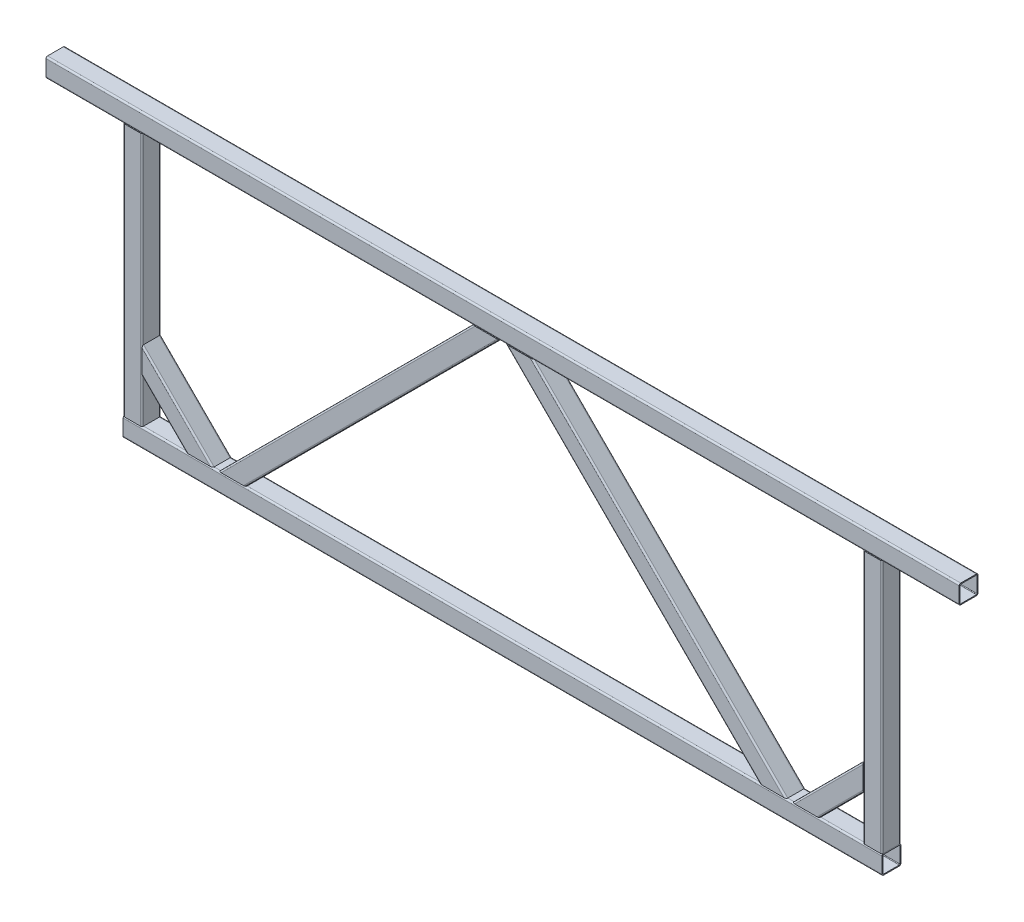
from build123d import *

# Parameters (mm, degrees)
F_60_X_40_X_3_2_1_DEPTH   = 2900
F_60_X_40_X_3_2_1_2_DEPTH = 2410
F_60_X_40_X_3_2_1_3_DEPTH = 868
F_60_X_40_X_3_2_1_4_DEPTH = 868
F_60_X_40_X_3_2_1_5_DEPTH = 428.703587107
F_60_X_40_X_3_2_1_6_DEPTH = 1311.561758757
F_60_X_40_X_3_2_1_7_DEPTH = 1311.561758757
F_60_X_40_X_3_2_1_8_DEPTH = 428.703587107


with BuildPart() as part:
    # Sketch1 → Прямоугольная труба 60 X 40 X 3.2(1) (new body)
    with BuildSketch(Plane(origin=(-1450, 433, 0), x_dir=(0, 1, 0), z_dir=(1, 0, 0))):
        with BuildLine():
            Line((-25, -30), (25, -30))
            ThreePointArc((25, -30), (28.535533906, -28.535533906), (30, -25))
            Line((30, -25), (30, 25))
            ThreePointArc((30, 25), (28.535533906, 28.535533906), (25, 30))
            Line((25, 30), (-25, 30))
            ThreePointArc((-25, 30), (-28.535533906, 28.535533906), (-30, 25))
            Line((-30, 25), (-30, -25))
            ThreePointArc((-30, -25), (-28.535533906, -28.535533906), (-25, -30))
        make_face()
        with BuildLine():
            Line((-25, -27), (25, -27))
            ThreePointArc((25, -27), (26.414213562, -26.414213562), (27, -25))
            Line((27, -25), (27, 25))
            ThreePointArc((27, 25), (26.414213562, 26.414213562), (25, 27))
            Line((25, 27), (-25, 27))
            ThreePointArc((-25, 27), (-26.414213562, 26.414213562), (-27, 25))
            Line((-27, 25), (-27, -25))
            ThreePointArc((-27, -25), (-26.414213562, -26.414213562), (-25, -27))
        make_face(mode=Mode.SUBTRACT)
    extrude(amount=F_60_X_40_X_3_2_1_DEPTH)


with BuildPart() as body_2:
    # Sketch1 on segment 2 (carried to segment 2) → 60 X 40 X 3.2_1 2 (new body)
    with BuildSketch(Plane(origin=(-1205, -433, 0), x_dir=(0, 1, 0), z_dir=(1, 0, 0))):
        with BuildLine():
            Line((-25, -30), (25, -30))
            ThreePointArc((25, -30), (28.535533906, -28.535533906), (30, -25))
            Line((30, -25), (30, 25))
            ThreePointArc((30, 25), (28.535533906, 28.535533906), (25, 30))
            Line((25, 30), (-25, 30))
            ThreePointArc((-25, 30), (-28.535533906, 28.535533906), (-30, 25))
            Line((-30, 25), (-30, -25))
            ThreePointArc((-30, -25), (-28.535533906, -28.535533906), (-25, -30))
        make_face()
        with BuildLine():
            Line((-25, -27), (25, -27))
            ThreePointArc((25, -27), (26.414213562, -26.414213562), (27, -25))
            Line((27, -25), (27, 25))
            ThreePointArc((27, 25), (26.414213562, 26.414213562), (25, 27))
            Line((25, 27), (-25, 27))
            ThreePointArc((-25, 27), (-26.414213562, 26.414213562), (-27, 25))
            Line((-27, 25), (-27, -25))
            ThreePointArc((-27, -25), (-26.414213562, -26.414213562), (-25, -27))
        make_face(mode=Mode.SUBTRACT)
    extrude(amount=F_60_X_40_X_3_2_1_2_DEPTH)


with BuildPart() as body_3:
    # Sketch1 on segment 3 (carried to segment 3) → 60 X 40 X 3.2_1 3 (new body)
    with BuildSketch(Plane(origin=(-1175, 434, 0), x_dir=(1, 0, 0), z_dir=(0, -1, 0))):
        with BuildLine():
            Line((-25, -30), (25, -30))
            ThreePointArc((25, -30), (28.535533906, -28.535533906), (30, -25))
            Line((30, -25), (30, 25))
            ThreePointArc((30, 25), (28.535533906, 28.535533906), (25, 30))
            Line((25, 30), (-25, 30))
            ThreePointArc((-25, 30), (-28.535533906, 28.535533906), (-30, 25))
            Line((-30, 25), (-30, -25))
            ThreePointArc((-30, -25), (-28.535533906, -28.535533906), (-25, -30))
        make_face()
        with BuildLine():
            Line((-25, -27), (25, -27))
            ThreePointArc((25, -27), (26.414213562, -26.414213562), (27, -25))
            Line((27, -25), (27, 25))
            ThreePointArc((27, 25), (26.414213562, 26.414213562), (25, 27))
            Line((25, 27), (-25, 27))
            ThreePointArc((-25, 27), (-26.414213562, 26.414213562), (-27, 25))
            Line((-27, 25), (-27, -25))
            ThreePointArc((-27, -25), (-26.414213562, -26.414213562), (-25, -27))
        make_face(mode=Mode.SUBTRACT)
    extrude(amount=F_60_X_40_X_3_2_1_3_DEPTH)

    # 60 X 40 X 3.2_1 3 end butt 1
    split(bisect_by=Plane(origin=(-1175, 403, 0), x_dir=(1, 0, 0), z_dir=(0, -1, 0)), keep=Keep.TOP)

    # 60 X 40 X 3.2_1 3 end butt 2
    split(bisect_by=Plane(origin=(-1175, -403, 0), x_dir=(-1, 0, 0), z_dir=(0, 1, 0)), keep=Keep.TOP)


with BuildPart() as body_4:
    # Sketch1 on segment 4 (carried to segment 4) → 60 X 40 X 3.2_1 4 (new body)
    with BuildSketch(Plane(origin=(1175, 434, 0), x_dir=(1, 0, 0), z_dir=(0, -1, 0))):
        with BuildLine():
            Line((-25, -30), (25, -30))
            ThreePointArc((25, -30), (28.535533906, -28.535533906), (30, -25))
            Line((30, -25), (30, 25))
            ThreePointArc((30, 25), (28.535533906, 28.535533906), (25, 30))
            Line((25, 30), (-25, 30))
            ThreePointArc((-25, 30), (-28.535533906, 28.535533906), (-30, 25))
            Line((-30, 25), (-30, -25))
            ThreePointArc((-30, -25), (-28.535533906, -28.535533906), (-25, -30))
        make_face()
        with BuildLine():
            Line((-25, -27), (25, -27))
            ThreePointArc((25, -27), (26.414213562, -26.414213562), (27, -25))
            Line((27, -25), (27, 25))
            ThreePointArc((27, 25), (26.414213562, 26.414213562), (25, 27))
            Line((25, 27), (-25, 27))
            ThreePointArc((-25, 27), (-26.414213562, 26.414213562), (-27, 25))
            Line((-27, 25), (-27, -25))
            ThreePointArc((-27, -25), (-26.414213562, -26.414213562), (-25, -27))
        make_face(mode=Mode.SUBTRACT)
    extrude(amount=F_60_X_40_X_3_2_1_4_DEPTH)

    # 60 X 40 X 3.2_1 4 end butt 1
    split(bisect_by=Plane(origin=(1175, 403, 0), x_dir=(1, 0, 0), z_dir=(0, -1, 0)), keep=Keep.TOP)

    # 60 X 40 X 3.2_1 4 end butt 2
    split(bisect_by=Plane(origin=(1175, -403, 0), x_dir=(-1, 0, 0), z_dir=(0, 1, 0)), keep=Keep.TOP)


with BuildPart() as body_5:
    # Sketch1 on segment 5 (carried to segment 5) → 60 X 40 X 3.2_1 5 (new body)
    with BuildSketch(Plane(origin=(-902.567893219, -463.707106781, 0), x_dir=(-0.707106781, -0.707106781, 0), z_dir=(-0.707106781, 0.707106781, 0))):
        with BuildLine():
            Line((-25, -30), (25, -30))
            ThreePointArc((25, -30), (28.535533906, -28.535533906), (30, -25))
            Line((30, -25), (30, 25))
            ThreePointArc((30, 25), (28.535533906, 28.535533906), (25, 30))
            Line((25, 30), (-25, 30))
            ThreePointArc((-25, 30), (-28.535533906, 28.535533906), (-30, 25))
            Line((-30, 25), (-30, -25))
            ThreePointArc((-30, -25), (-28.535533906, -28.535533906), (-25, -30))
        make_face()
        with BuildLine():
            Line((-25, -27), (25, -27))
            ThreePointArc((25, -27), (26.414213562, -26.414213562), (27, -25))
            Line((27, -25), (27, 25))
            ThreePointArc((27, 25), (26.414213562, 26.414213562), (25, 27))
            Line((25, 27), (-25, 27))
            ThreePointArc((-25, 27), (-26.414213562, 26.414213562), (-27, 25))
            Line((-27, 25), (-27, -25))
            ThreePointArc((-27, -25), (-26.414213562, -26.414213562), (-25, -27))
        make_face(mode=Mode.SUBTRACT)
    extrude(amount=F_60_X_40_X_3_2_1_5_DEPTH)

    # 60 X 40 X 3.2_1 5 end butt 1
    split(bisect_by=Plane(origin=(-933.275, -403, 0), x_dir=(-1, 0, 0), z_dir=(0, 1, 0)), keep=Keep.TOP)

    # 60 X 40 X 3.2_1 5 end butt 2
    split(bisect_by=Plane(origin=(-1145, -191.275, 0), x_dir=(0, 1, 0), z_dir=(1, 0, 0)), keep=Keep.TOP)


with BuildPart() as body_6:
    # Sketch1 on segment 6 (carried to segment 6) → 60 X 40 X 3.2_1 6 (new body)
    with BuildSketch(Plane(origin=(-919.132106781, -463.707106781, 0), x_dir=(-0.707106781, 0.707106781, 0), z_dir=(0.707106781, 0.707106781, 0))):
        with BuildLine():
            Line((-25, -30), (25, -30))
            ThreePointArc((25, -30), (28.535533906, -28.535533906), (30, -25))
            Line((30, -25), (30, 25))
            ThreePointArc((30, 25), (28.535533906, 28.535533906), (25, 30))
            Line((25, 30), (-25, 30))
            ThreePointArc((-25, 30), (-28.535533906, 28.535533906), (-30, 25))
            Line((-30, 25), (-30, -25))
            ThreePointArc((-30, -25), (-28.535533906, -28.535533906), (-25, -30))
        make_face()
        with BuildLine():
            Line((-25, -27), (25, -27))
            ThreePointArc((25, -27), (26.414213562, -26.414213562), (27, -25))
            Line((27, -25), (27, 25))
            ThreePointArc((27, 25), (26.414213562, 26.414213562), (25, 27))
            Line((25, 27), (-25, 27))
            ThreePointArc((-25, 27), (-26.414213562, 26.414213562), (-27, 25))
            Line((-27, 25), (-27, -25))
            ThreePointArc((-27, -25), (-26.414213562, -26.414213562), (-25, -27))
        make_face(mode=Mode.SUBTRACT)
    extrude(amount=F_60_X_40_X_3_2_1_6_DEPTH)

    # 60 X 40 X 3.2_1 6 end butt 1
    split(bisect_by=Plane(origin=(-888.425, -403, 0), x_dir=(-1, 0, 0), z_dir=(0, 1, 0)), keep=Keep.TOP)

    # 60 X 40 X 3.2_1 6 end butt 2
    split(bisect_by=Plane(origin=(-22.425, 403, 0), x_dir=(1, 0, 0), z_dir=(0, -1, 0)), keep=Keep.TOP)


with BuildPart() as body_7:
    # Sketch1 on segment 7 (carried to segment 7) → 60 X 40 X 3.2_1 7 (new body)
    with BuildSketch(Plane(origin=(919.132106781, -463.707106781, 0), x_dir=(-0.707106781, -0.707106781, 0), z_dir=(-0.707106781, 0.707106781, 0))):
        with BuildLine():
            Line((-25, -30), (25, -30))
            ThreePointArc((25, -30), (28.535533906, -28.535533906), (30, -25))
            Line((30, -25), (30, 25))
            ThreePointArc((30, 25), (28.535533906, 28.535533906), (25, 30))
            Line((25, 30), (-25, 30))
            ThreePointArc((-25, 30), (-28.535533906, 28.535533906), (-30, 25))
            Line((-30, 25), (-30, -25))
            ThreePointArc((-30, -25), (-28.535533906, -28.535533906), (-25, -30))
        make_face()
        with BuildLine():
            Line((-25, -27), (25, -27))
            ThreePointArc((25, -27), (26.414213562, -26.414213562), (27, -25))
            Line((27, -25), (27, 25))
            ThreePointArc((27, 25), (26.414213562, 26.414213562), (25, 27))
            Line((25, 27), (-25, 27))
            ThreePointArc((-25, 27), (-26.414213562, 26.414213562), (-27, 25))
            Line((-27, 25), (-27, -25))
            ThreePointArc((-27, -25), (-26.414213562, -26.414213562), (-25, -27))
        make_face(mode=Mode.SUBTRACT)
    extrude(amount=F_60_X_40_X_3_2_1_7_DEPTH)

    # 60 X 40 X 3.2_1 7 end butt 1
    split(bisect_by=Plane(origin=(888.425, -403, 0), x_dir=(-1, 0, 0), z_dir=(0, 1, 0)), keep=Keep.TOP)

    # 60 X 40 X 3.2_1 7 end butt 2
    split(bisect_by=Plane(origin=(22.425, 403, 0), x_dir=(1, 0, 0), z_dir=(0, -1, 0)), keep=Keep.TOP)


with BuildPart() as body_8:
    # Sketch1 on segment 8 (carried to segment 8) → 60 X 40 X 3.2_1 8 (new body)
    with BuildSketch(Plane(origin=(902.567893219, -463.707106781, 0), x_dir=(-0.707106781, 0.707106781, 0), z_dir=(0.707106781, 0.707106781, 0))):
        with BuildLine():
            Line((-25, -30), (25, -30))
            ThreePointArc((25, -30), (28.535533906, -28.535533906), (30, -25))
            Line((30, -25), (30, 25))
            ThreePointArc((30, 25), (28.535533906, 28.535533906), (25, 30))
            Line((25, 30), (-25, 30))
            ThreePointArc((-25, 30), (-28.535533906, 28.535533906), (-30, 25))
            Line((-30, 25), (-30, -25))
            ThreePointArc((-30, -25), (-28.535533906, -28.535533906), (-25, -30))
        make_face()
        with BuildLine():
            Line((-25, -27), (25, -27))
            ThreePointArc((25, -27), (26.414213562, -26.414213562), (27, -25))
            Line((27, -25), (27, 25))
            ThreePointArc((27, 25), (26.414213562, 26.414213562), (25, 27))
            Line((25, 27), (-25, 27))
            ThreePointArc((-25, 27), (-26.414213562, 26.414213562), (-27, 25))
            Line((-27, 25), (-27, -25))
            ThreePointArc((-27, -25), (-26.414213562, -26.414213562), (-25, -27))
        make_face(mode=Mode.SUBTRACT)
    extrude(amount=F_60_X_40_X_3_2_1_8_DEPTH)

    # 60 X 40 X 3.2_1 8 end butt 1
    split(bisect_by=Plane(origin=(933.275, -403, 0), x_dir=(-1, 0, 0), z_dir=(0, 1, 0)), keep=Keep.TOP)

    # 60 X 40 X 3.2_1 8 end butt 2
    split(bisect_by=Plane(origin=(1145, -191.275, 0), x_dir=(0, -1, 0), z_dir=(-1, 0, 0)), keep=Keep.TOP)


solid = Compound([part.part, body_2.part, body_3.part, body_4.part, body_5.part, body_6.part, body_7.part, body_8.part])
